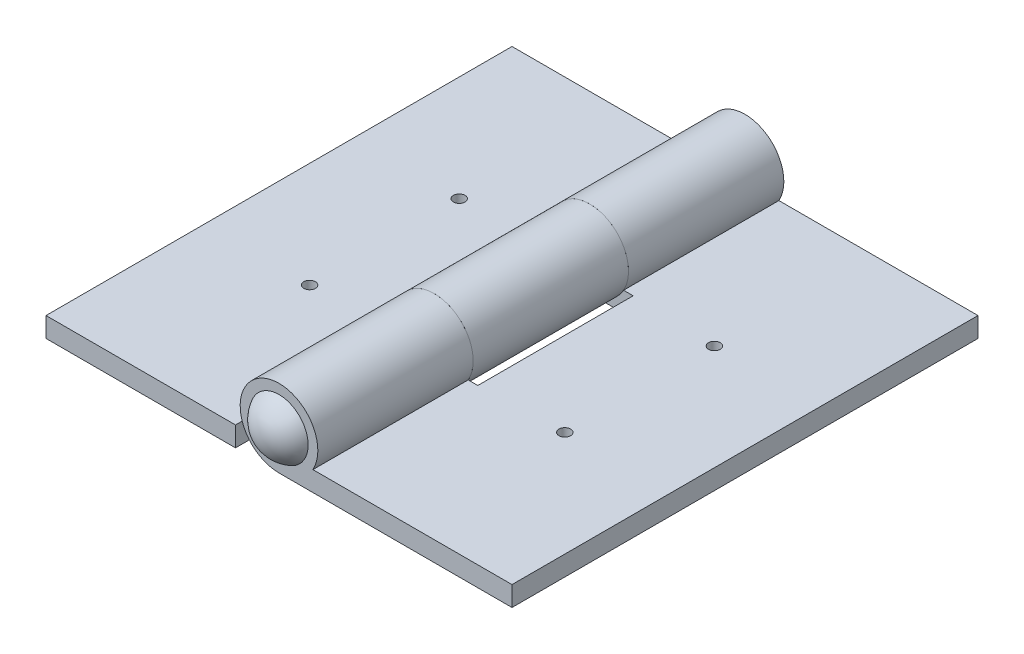
from build123d import *

# Parameters (mm, degrees)
SKETCH1_R                         = 1.5875
EXTRUDE1_DEPTH                    = 19.05
SKETCH1_W                         = 15.494
SKETCH1_H                         = 1.6256
EXTRUDE1_2_DEPTH                  = 19.05
EXTRUDE4_DEPTH                    = 29.173887468
EXTRUDE4_DEPTH_BACK               = 29.173887468
SKETCH8_W                         = 7.112
SKETCH8_H                         = 12.7
SKETCH9_R                         = 1.5875
EXTRUDE5_DEPTH                    = 12.7
SKETCH22_W                        = 0.475
SKETCH22_H                        = 1.6266
M1_2X0_25_TAPPED_HOLE1_AT_2_COUNT = 2
M1_2X0_25_TAPPED_HOLE1_AT_2_PITCH = 12.23
SKETCH23_W                        = 0.475
SKETCH23_H                        = 1.62665
M1_2X0_25_TAPPED_HOLE2_AT_2_COUNT = 2
M1_2X0_25_TAPPED_HOLE2_AT_2_PITCH = 12.23


with BuildPart() as part:
    # Sketch1 → Extrude1 (new, symmetric)
    with BuildSketch(Plane.XY):
        with BuildLine():
            Line((19.05, -3.175), (0, -3.175))
            ThreePointArc((0, -3.175), (-1.606437051, 2.738610049), (2.771278521, -1.5494))
            Line((2.771278521, -1.5494), (19.05, -1.5494))
            Line((19.05, -1.5494), (19.05, -3.175))
        make_face()
        with Locations(Location((0, 0, 0), (0, 0, 180))):
            Circle(SKETCH1_R, mode=Mode.SUBTRACT)
    extrude(amount=EXTRUDE1_DEPTH, both=True)

    # Sketch8 → Extrude4 (cut, two sides: drawn at the far end of the back side and taken through both)
    with BuildSketch(Plane(origin=(0, 0, 0), x_dir=(1, 0, 0), z_dir=(0, 1, 0)).offset(-EXTRUDE4_DEPTH_BACK)):
        Rectangle(SKETCH8_W, SKETCH8_H)
    extrude(amount=EXTRUDE4_DEPTH + EXTRUDE4_DEPTH_BACK, mode=Mode.SUBTRACT)

    # Sketch22 → M1.2x0.25 Tapped Hole1 (revolve, cut)
    with BuildSketch(Plane(origin=(10.43, -3.175, -6.115), x_dir=(0, 0, -1), z_dir=(1, 0, 0))):
        with Locations((0.2375, 0.8133)):
            Rectangle(SKETCH22_W, SKETCH22_H)
    m1_2x0_25_tapped_hole1 = revolve(axis=Axis((10.43, -9.525, -6.115), (0, 1, 0)), mode=Mode.SUBTRACT)

    # M1.2x0.25 Tapped Hole1 at 2: M1.2x0.25 Tapped Hole1 ×2
    with Locations(*[(0, 0, i * M1_2X0_25_TAPPED_HOLE1_AT_2_PITCH) for i in range(1, M1_2X0_25_TAPPED_HOLE1_AT_2_COUNT)]):
        add(m1_2x0_25_tapped_hole1, mode=Mode.SUBTRACT)


with BuildPart() as body_2:
    # Sketch1 → Extrude1 2 (new, symmetric)
    with BuildSketch(Plane.XY):
        with Locations((-11.303, -2.3622)):
            Rectangle(SKETCH1_W, SKETCH1_H)
    extrude(amount=EXTRUDE1_2_DEPTH, both=True)

    # Sketch9 → Extrude5 (add)
    with BuildSketch(Plane.XY.offset(-6.35)):
        with BuildLine():
            Line((-2.771278521, -1.5494), (-3.556, -1.5494))
            Line((-3.556, -1.5494), (-3.556, -3.175))
            Line((-3.556, -3.175), (0, -3.175))
            ThreePointArc((0, -3.175), (1.606437051, 2.738610049), (-2.771278521, -1.5494))
        make_face()
        with Locations(Location((0, 0, 0), (0, 0, 180))):
            Circle(SKETCH9_R, mode=Mode.SUBTRACT)
    extrude(amount=EXTRUDE5_DEPTH)

    # Sketch23 → M1.2x0.25 Tapped Hole2 (revolve, cut)
    with BuildSketch(Plane(origin=(-10.43, -3.175, -6.115), x_dir=(0, 0, -1), z_dir=(1, 0, 0))):
        with Locations((0.2375, 0.813325)):
            Rectangle(SKETCH23_W, SKETCH23_H)
    m1_2x0_25_tapped_hole2 = revolve(axis=Axis((-10.43, -9.525, -6.115), (0, 1, 0)), mode=Mode.SUBTRACT)

    # M1.2x0.25 Tapped Hole2 at 2: M1.2x0.25 Tapped Hole2 ×2
    with Locations(*[(0, 0, i * M1_2X0_25_TAPPED_HOLE2_AT_2_PITCH) for i in range(1, M1_2X0_25_TAPPED_HOLE2_AT_2_COUNT)]):
        add(m1_2x0_25_tapped_hole2, mode=Mode.SUBTRACT)


with BuildPart() as body_3:
    # Sketch6 → Revolve1 (revolve)
    with BuildSketch(Plane(origin=(0, 0, 0), x_dir=(1, 0, 0), z_dir=(0, 1, 0)), mode=Mode.PRIVATE) as revolve1_sk:
        with BuildLine():
            Line((-2.38125, 19.05), (-1.5875, 19.05))
            Line((-1.5875, 19.05), (-1.5875, -19.05))
            Line((-1.5875, -19.05), (-2.38125, -19.05))
            ThreePointArc((-2.38125, -19.05), (-1.397393789, -20.118057742), (0, -20.51304))
            Line((0, -20.51304), (0, 20.51304))
            ThreePointArc((0, 20.51304), (-1.397393789, 20.118057742), (-2.38125, 19.05))
        make_face()
    revolve(revolve1_sk.sketch.rotate(Axis((0, 0, -20.51304), (0, 0, 1)), 180), axis=Axis((0, 0, -20.51304), (0, 0, 1)))


solid = Compound([part.part, body_2.part, body_3.part])
